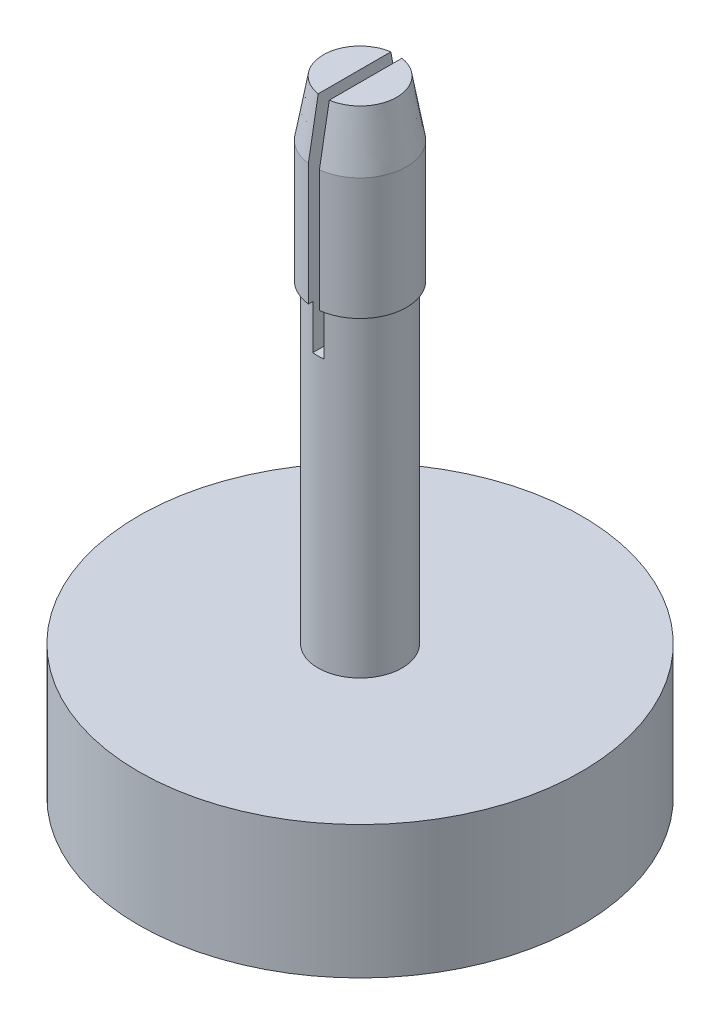
from build123d import *

# Parameters (mm, degrees)
ESQUISSE2_R             = 5
BOSS_EXTRU_1_DEPTH      = 3
ESQUISSE3_R             = 0.95
BOSS_EXTRU_2_DEPTH      = 7.1
ESQUISSE4_R             = 1.05
BOSS_EXTRU_3_DEPTH      = 4
CHANFREIN3_SIZE         = 1.25
CHANFREIN3_SIZE2        = 0.220408726
ESQUISSE5_W             = 0.25
ESQUISSE5_H             = 3
ENL_V_MAT_EXTRU_1_DEPTH = 5


with BuildPart() as part:
    # Esquisse2 → Boss.-Extru.1 (new body)
    with BuildSketch(Plane(origin=(0, 0, 0), x_dir=(1, 0, 0), z_dir=(0, 1, 0))):
        with Locations(Location((0, 0, 0), (0, 0, 270))):
            Circle(ESQUISSE2_R)
    extrude(amount=BOSS_EXTRU_1_DEPTH)

    # Esquisse3 → Boss.-Extru.2 (add)
    with BuildSketch(Plane(origin=(0, 3, 0), x_dir=(1, 0, 0), z_dir=(0, 1, 0))):
        with Locations(Location((0, 0, 0), (0, 0, 270))):
            Circle(ESQUISSE3_R)
    extrude(amount=BOSS_EXTRU_2_DEPTH)

    # Esquisse4 → Boss.-Extru.3 (add)
    with BuildSketch(Plane(origin=(0, 10.1, 0), x_dir=(1, 0, 0), z_dir=(0, 1, 0))):
        with Locations(Location((0, 0, 0), (0, 0, 270))):
            Circle(ESQUISSE4_R)
    extrude(amount=BOSS_EXTRU_3_DEPTH)

    # Chanfrein3
    chanfrein3_edges = [part.edges().sort_by_distance(p)[0] for p in [
        (0, 14.1, -1.05),
    ]]
    chanfrein3_side = [part.faces().sort_by_distance(p)[0] for p in [
        (0, 12.1, -1.05),
    ]]
    chamfer(chanfrein3_edges, length=CHANFREIN3_SIZE, length2=CHANFREIN3_SIZE2, reference=chanfrein3_side[0])

    # Esquisse5 → Enlèv. mat.-Extru.1 (cut)
    with BuildSketch(Plane(origin=(0, 14.1, 0), x_dir=(1, 0, 0), z_dir=(0, 1, 0))):
        Rectangle(ESQUISSE5_W, ESQUISSE5_H)
    extrude(amount=-ENL_V_MAT_EXTRU_1_DEPTH, mode=Mode.SUBTRACT)


solid = part.part
